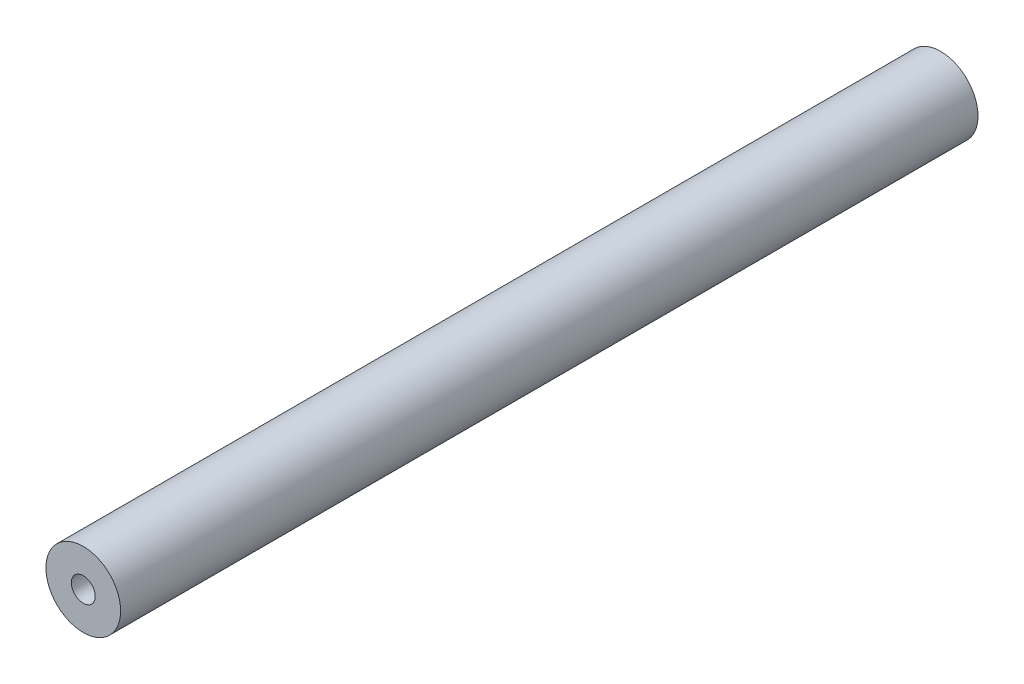
from build123d import *

# Parameters (mm, degrees)
SKETCH1_R           = 12.5
BOSS_EXTRUDE1_DEPTH = 287
SKETCH2_R           = 4
CUT_EXTRUDE1_DEPTH  = 395


with BuildPart() as part:
    # Sketch1 → Boss-Extrude1 (new body)
    with BuildSketch(Plane.XY):
        Circle(SKETCH1_R)
    extrude(amount=BOSS_EXTRUDE1_DEPTH)

    # Sketch2 → Cut-Extrude1 (cut)
    with BuildSketch(Plane.XY):
        with Locations(Location((0, 0, 0), (0, 0, 180))):
            Circle(SKETCH2_R)
    extrude(amount=CUT_EXTRUDE1_DEPTH, mode=Mode.SUBTRACT)


solid = part.part
